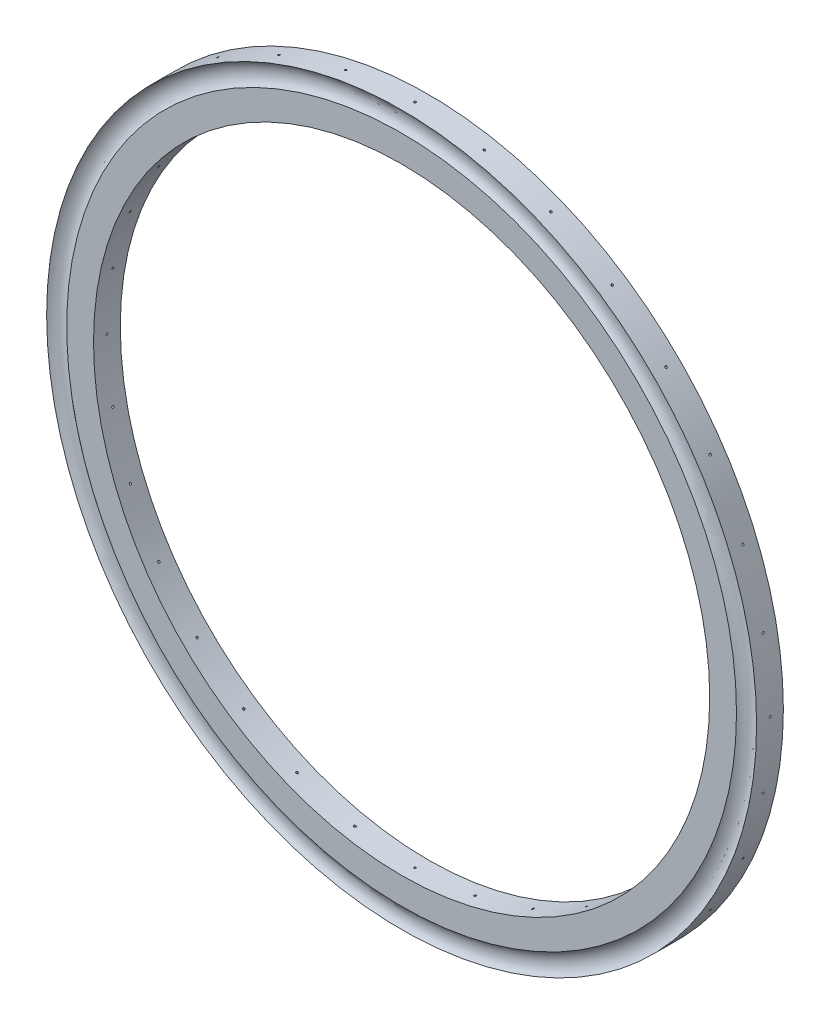
from build123d import *

# Parameters (mm, degrees)
SKETCH2_R          = 1.000000032
CUT_EXTRUDE1_DEPTH = 477.122983062
CIRPATTERN1_COUNT  = 32


with BuildPart() as part:
    # Sketch1 → Revolve1 (revolve)
    with BuildSketch(Plane(origin=(0, 0, 0), x_dir=(1, 0, 0), z_dir=(0, 1, 0))):
        with BuildLine():
            Line((317.5, 12.7), (292.1, 12.7))
            Line((292.1, 12.7), (292.1, -12.7))
            Line((292.1, -12.7), (317.5, -12.7))
            ThreePointArc((317.5, -12.7), (327.025, -9.021044247), (336.55, -12.7))
            Line((336.55, -12.7), (336.55, 12.7))
            ThreePointArc((336.55, 12.7), (327.025, 9.021044247), (317.5, 12.7))
        make_face()
    revolve(axis=Axis((0, 0, 0), (0, 0, -1)))

    # Sketch2 → Cut-Extrude1 (cut, through all)
    with BuildSketch(Plane(origin=(0, 0, 0), x_dir=(0, 0, -1), z_dir=(1, 0, 0))):
        Circle(SKETCH2_R)
    cut_extrude1 = extrude(amount=-CUT_EXTRUDE1_DEPTH, mode=Mode.SUBTRACT)

    # CirPattern1: Cut-Extrude1 ×32 about axis
    cirpattern1_axis = Axis((0, 0, 0), (0, 0, -1))
    for i in range(1, CIRPATTERN1_COUNT):
        add(cut_extrude1.rotate(cirpattern1_axis, i * 360 / CIRPATTERN1_COUNT), mode=Mode.SUBTRACT)


solid = part.part
